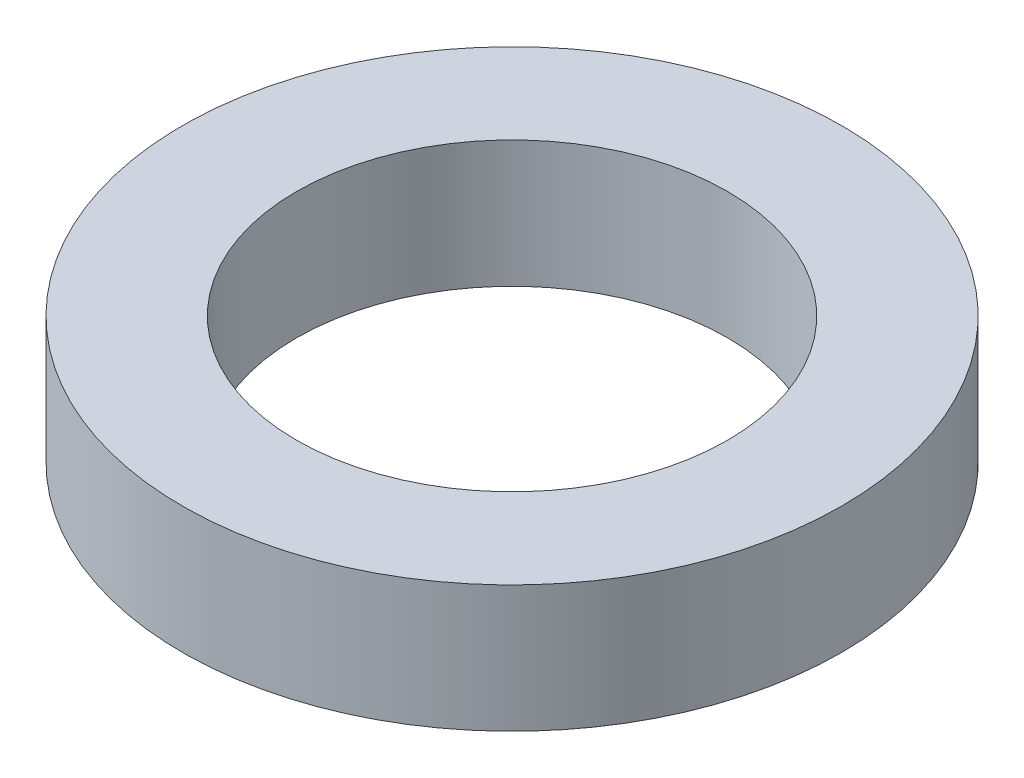
from build123d import *

# Parameters (mm, degrees)
SKETCH_1_R      = 13
SKETCH_1_R_2    = 8.5
EXTRUDE_1_DEPTH = 5


with BuildPart() as part:
    # 草图1 → 拉伸-薄壁1 (new body)
    with BuildSketch(Plane(origin=(0, 0, 0), x_dir=(1, 0, 0), z_dir=(0, 1, 0))):
        Circle(SKETCH_1_R)
        Circle(SKETCH_1_R_2, mode=Mode.SUBTRACT)
    extrude(amount=EXTRUDE_1_DEPTH)


solid = part.part
